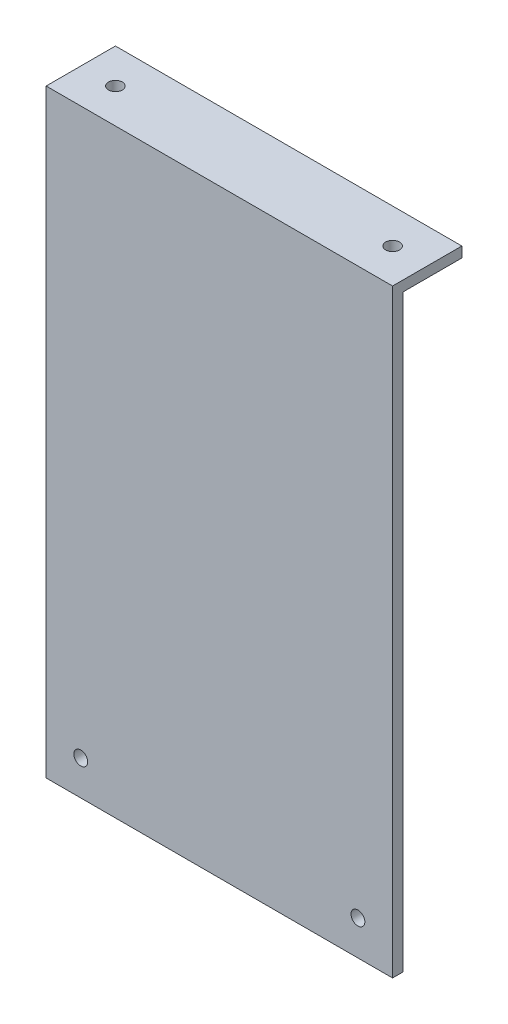
from build123d import *

# Parameters (mm, degrees)
SKETCH1_W           = 100
SKETCH1_H           = 20
BOSS_EXTRUDE1_DEPTH = 3
CUT_EXTRUDE1_REACH  = 53.078
SKETCH2_R           = 2
SKETCH3_W           = 100
SKETCH3_H           = 3
BOSS_EXTRUDE2_DEPTH = 170
CUT_EXTRUDE2_REACH  = 180.326
SKETCH4_R           = 2


with BuildPart() as part:
    # Sketch1 → Boss-Extrude1 (new body)
    with BuildSketch(Plane(origin=(0, 0, 0), x_dir=(1, 0, 0), z_dir=(0, 1, 0))):
        Rectangle(SKETCH1_W, SKETCH1_H)
    extrude(amount=BOSS_EXTRUDE1_DEPTH)

    # Sketch2 → Cut-Extrude1 (cut, up to next)
    with BuildSketch(Plane(origin=(0, 3, 0), x_dir=(1, 0, 0), z_dir=(0, 1, 0)), mode=Mode.PRIVATE) as cut_extrude1_sk1:
        with Locations(Location((40, 0, 0), (0, 0, 270))):
            Circle(SKETCH2_R)
    cut_extrude1_tool1 = extrude(cut_extrude1_sk1.sketch, amount=-CUT_EXTRUDE1_REACH, mode=Mode.PRIVATE) & part.part
    # Sketch2 → Cut-Extrude1 (cut, up to next)
    with BuildSketch(Plane(origin=(0, 3, 0), x_dir=(1, 0, 0), z_dir=(0, 1, 0)), mode=Mode.PRIVATE) as cut_extrude1_sk2:
        with Locations(Location((-40, 0, 0), (0, 0, 270))):
            Circle(SKETCH2_R)
    cut_extrude1_tool2 = extrude(cut_extrude1_sk2.sketch, amount=-CUT_EXTRUDE1_REACH, mode=Mode.PRIVATE) & part.part
    add(cut_extrude1_tool1.solids().sort_by_distance((40, 3, 0))[0], mode=Mode.SUBTRACT)
    add(cut_extrude1_tool2.solids().sort_by_distance((-40, 3, 0))[0], mode=Mode.SUBTRACT)

    # Sketch3 → Boss-Extrude2 (add)
    with BuildSketch(Plane.XZ):
        with Locations((0, 8.5)):
            Rectangle(SKETCH3_W, SKETCH3_H)
    extrude(amount=BOSS_EXTRUDE2_DEPTH)

    # Sketch4 → Cut-Extrude2 (cut, up to next)
    with BuildSketch(Plane.XY.offset(10), mode=Mode.PRIVATE) as cut_extrude2_sk1:
        with Locations((-40, -160)):
            Circle(SKETCH4_R)
    cut_extrude2_tool1 = extrude(cut_extrude2_sk1.sketch, amount=-CUT_EXTRUDE2_REACH, mode=Mode.PRIVATE) & part.part
    # Sketch4 → Cut-Extrude2 (cut, up to next)
    with BuildSketch(Plane.XY.offset(10), mode=Mode.PRIVATE) as cut_extrude2_sk2:
        with Locations((40, -160)):
            Circle(SKETCH4_R)
    cut_extrude2_tool2 = extrude(cut_extrude2_sk2.sketch, amount=-CUT_EXTRUDE2_REACH, mode=Mode.PRIVATE) & part.part
    add(cut_extrude2_tool1.solids().sort_by_distance((-40, -160, 10))[0], mode=Mode.SUBTRACT)
    add(cut_extrude2_tool2.solids().sort_by_distance((40, -160, 10))[0], mode=Mode.SUBTRACT)


solid = part.part
